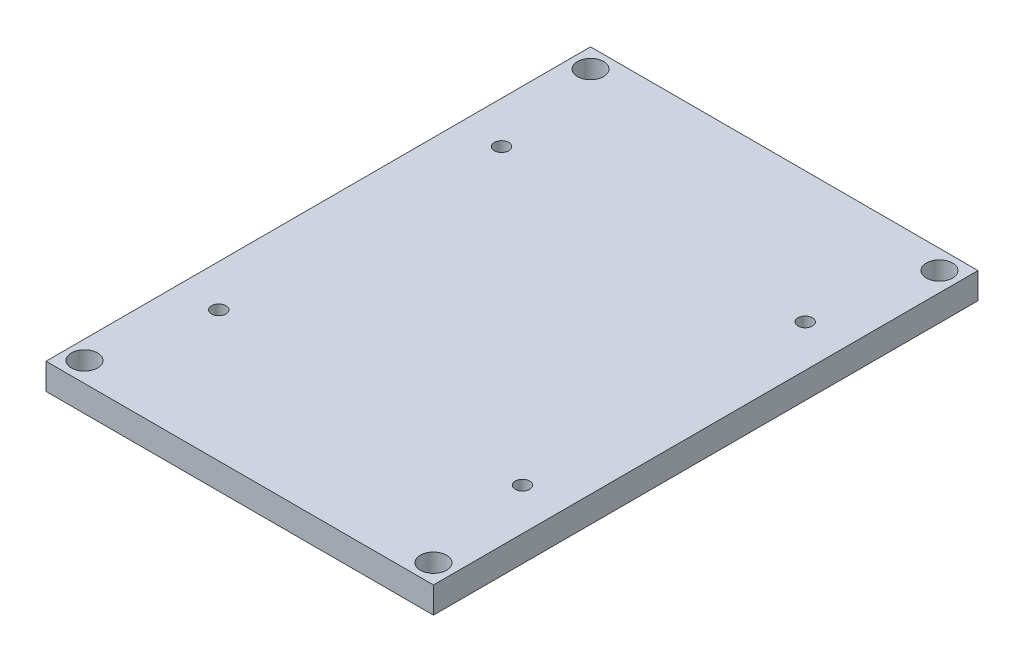
from build123d import *

# Parameters (mm, degrees)
SKETCH1_W           = 93.98
SKETCH1_H           = 132.08
BOSS_EXTRUDE2_DEPTH = 6.35
SKETCH2_R           = 3.175
CUT_EXTRUDE1_DEPTH  = 6.35
SKETCH3_R           = 1.7526
CUT_EXTRUDE2_DEPTH  = 6.35


with BuildPart() as part:
    # Sketch1 → Boss-Extrude2 (new body)
    with BuildSketch(Plane(origin=(0, 0, 0), x_dir=(1, 0, 0), z_dir=(0, 1, 0))):
        Rectangle(SKETCH1_W, SKETCH1_H)
    extrude(amount=BOSS_EXTRUDE2_DEPTH)

    # Sketch2 → Cut-Extrude1 (cut)
    with BuildSketch(Plane(origin=(0, 6.35, 0), x_dir=(1, 0, 0), z_dir=(0, 1, 0))):
        with Locations(Location((-42.320266817, 61.370266817, 0), (0, 0, 270))):
            Circle(SKETCH2_R)
        with Locations(Location((42.320266817, 61.370266817, 0), (0, 0, 270))):
            Circle(SKETCH2_R)
        with Locations(Location((-42.489307234, -61.20713536, 0), (0, 0, 270))):
            Circle(SKETCH2_R)
        with Locations(Location((42.320266817, -61.370266817, 0), (0, 0, 270))):
            Circle(SKETCH2_R)
    extrude(amount=-CUT_EXTRUDE1_DEPTH, mode=Mode.SUBTRACT)

    # Sketch3 → Cut-Extrude2 (cut)
    with BuildSketch(Plane(origin=(0, 6.35, 0), x_dir=(1, 0, 0), z_dir=(0, 1, 0))):
        with Locations(Location((-36.83, 34.29, 0), (0, 0, 270))):
            Circle(SKETCH3_R)
        with Locations(Location((36.83, 34.29, 0), (0, 0, 270))):
            Circle(SKETCH3_R)
        with Locations(Location((-36.83, -34.29, 0), (0, 0, 270))):
            Circle(SKETCH3_R)
        with Locations(Location((36.83, -34.29, 0), (0, 0, 270))):
            Circle(SKETCH3_R)
    extrude(amount=-CUT_EXTRUDE2_DEPTH, mode=Mode.SUBTRACT)


solid = part.part
